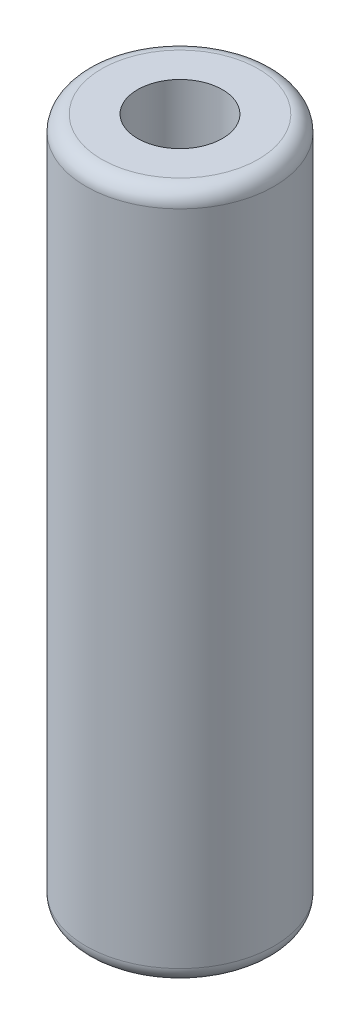
from build123d import *

# Parameters (mm, degrees)
BOSS_EXTRUDE1_DEPTH      = 10.99
BOSS_EXTRUDE1_DEPTH_BACK = 10.99
SKETCH1_R                = 3
FILLET1_R                = 0.5


with BuildPart() as part:
    # Sketch1 → Boss-Extrude1 (new, two sides: drawn at the far end of the back side and taken through both)
    with BuildSketch(Plane(origin=(0, 0, 0), x_dir=(1, 0, 0), z_dir=(0, 1, 0)).offset(-BOSS_EXTRUDE1_DEPTH_BACK)):
        Circle(SKETCH1_R)
    extrude(amount=BOSS_EXTRUDE1_DEPTH + BOSS_EXTRUDE1_DEPTH_BACK)

    # Sketch3 → #6-32 Tapped Hole1 (revolve, cut)
    with BuildSketch(Plane(origin=(0, 10.99, 0), x_dir=(0, 0, 1), z_dir=(1, 0, 0))):
        Polygon((0, 0), (0, 8.81269403), (1.35255, 8), (1.35255, 0), align=None)
    f_6_32_tapped_hole1 = revolve(axis=Axis((0, 17.34, 0), (0, -1, 0)), mode=Mode.SUBTRACT)

    # Fillet1
    fillet1_edges = [part.edges().sort_by_distance(p)[0] for p in [
        (-3, -10.99, 0),
        (-3, 10.99, 0),
    ]]
    fillet(fillet1_edges, radius=FILLET1_R)

    # Mirror1: #6-32 Tapped Hole1 across plane
    add(f_6_32_tapped_hole1.mirror(Plane.ZX), mode=Mode.SUBTRACT)


solid = part.part
